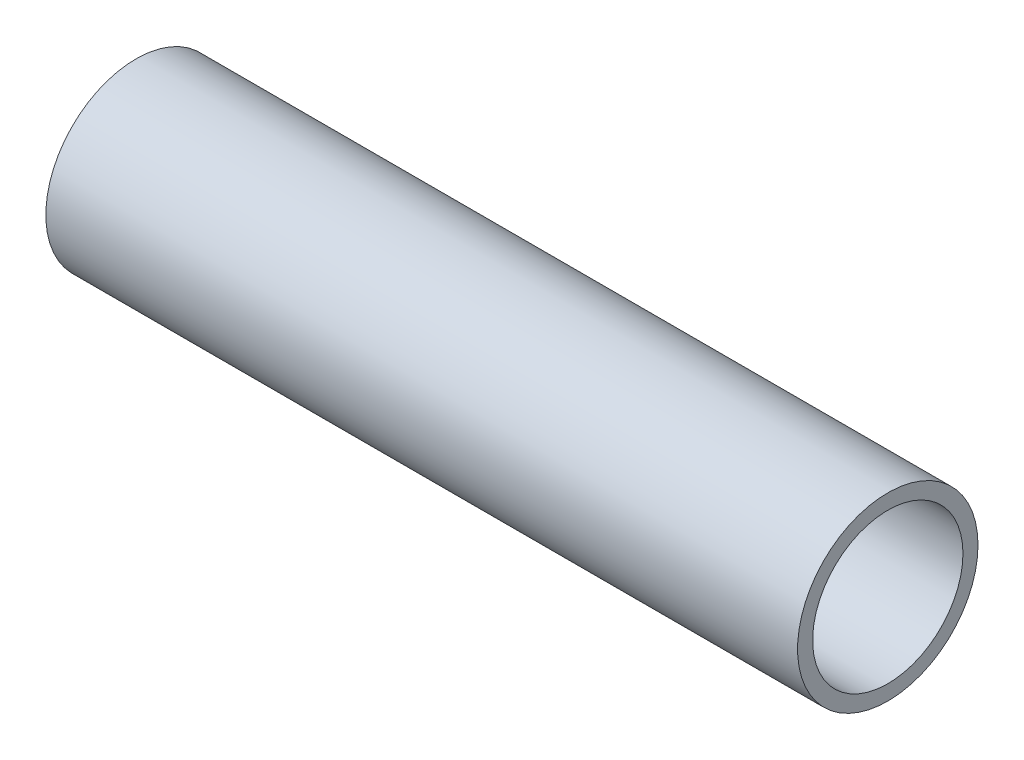
from build123d import *

# Parameters (mm, degrees)
SKETCH1_R           = 6
SKETCH1_R_2         = 5
BOSS_EXTRUDE1_DEPTH = 50


with BuildPart() as part:
    # Sketch1 → Boss-Extrude1 (new body)
    with BuildSketch(Plane(origin=(0, 0, 0), x_dir=(0, 0, -1), z_dir=(1, 0, 0))):
        Circle(SKETCH1_R)
        Circle(SKETCH1_R_2, mode=Mode.SUBTRACT)
    extrude(amount=BOSS_EXTRUDE1_DEPTH)


solid = part.part
